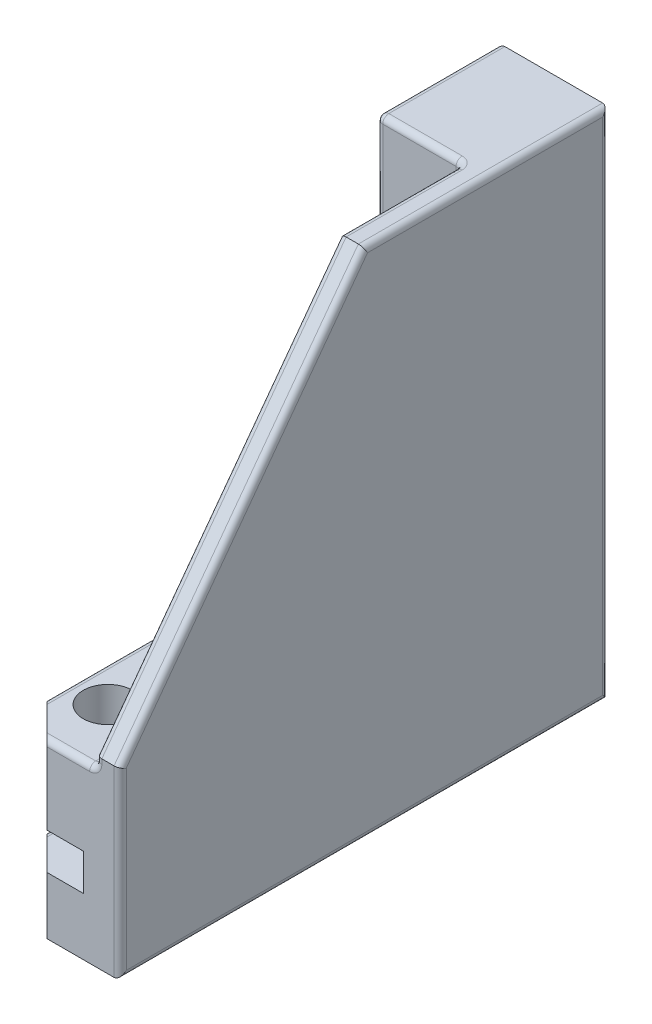
from build123d import *

# Parameters (mm, degrees)
SKETCH1_W           = 9
SKETCH1_H           = 42
SKETCH1_R           = 2.02
SKETCH1_R_2         = 1.5875
BOSS_EXTRUDE1_DEPTH = 40
SKETCH1_3_R         = 2.02
SKETCH1_3_R_2       = 1.5875
CUT_EXTRUDE1_DEPTH  = 8
SKETCH2_W           = 40
SKETCH2_H           = 3
CUT_EXTRUDE2_DEPTH  = 6
CUT_EXTRUDE3_DEPTH  = 9
CUT_EXTRUDE6_DEPTH  = 7
SKETCH6_R           = 2.0193
CUT_EXTRUDE5_DEPTH  = 20
FILLET2_R           = 0.5
CHAMFER4_SIZE       = 3
SKETCH7_W           = 74.310151154
SKETCH7_H           = 95.165931092
CUT_EXTRUDE7_DEPTH  = 9
FILLET3_R           = 0.5


with BuildPart() as part:
    # Sketch1 → Boss-Extrude1 (new body)
    # profile 1 of 4: a face of its own
    with BuildSketch(Plane.XY):
        with Locations((4.5, 21)):
            Rectangle(SKETCH1_W, SKETCH1_H)
        with Locations((4.5, 16)):
            Circle(SKETCH1_R, mode=Mode.SUBTRACT)
        with Locations((4.5, 28)):
            Circle(SKETCH1_R, mode=Mode.SUBTRACT)
    # profile 2 of 4: a face of its own
    with BuildSketch(Plane.XY):
        with Locations((4.5, 28)):
            Circle(SKETCH1_R)
    # profile 3 of 4: a face of its own
    with BuildSketch(Plane.XY):
        with Locations((4.5, 16)):
            Circle(SKETCH1_R)
    # profile 4 of 4: a face of its own
    with BuildSketch(Plane.XY):
        with Locations((4.5, 35)):
            Circle(SKETCH1_R_2)
    extrude(amount=BOSS_EXTRUDE1_DEPTH)

    # Sketch1<3> → Cut-Extrude1 (cut)
    with BuildSketch(Plane.XY):
        with Locations((4.5, 28)):
            Circle(SKETCH1_3_R)
        with Locations((4.5, 35)):
            Circle(SKETCH1_3_R_2)
        with Locations((4.5, 16)):
            Circle(SKETCH1_3_R)
    extrude(amount=CUT_EXTRUDE1_DEPTH, mode=Mode.SUBTRACT)

    # Sketch2 → Cut-Extrude2 (cut)
    with BuildSketch(Plane(origin=(9, 0, 0), x_dir=(0, 0, -1), z_dir=(1, 0, 0))):
        with Locations((-20, 6.2)):
            Rectangle(SKETCH2_W, SKETCH2_H)
    extrude(amount=-CUT_EXTRUDE2_DEPTH, mode=Mode.SUBTRACT)

    # Sketch3 → Cut-Extrude3 (cut)
    with BuildSketch(Plane(origin=(9, 0, 0), x_dir=(0, 0, -1), z_dir=(1, 0, 0))):
        Polygon((-20, 42), (-40, 15), (-48.379363257, 51.913157268), align=None)
    extrude(amount=-CUT_EXTRUDE3_DEPTH, mode=Mode.SUBTRACT)

    # Sketch5 → Cut-Extrude6 (cut)
    with BuildSketch(Plane.ZY.offset(-9)):
        Polygon((20, 42), (10, 42), (10, 14.1), (40, 14.1), (40, 15), align=None)
    extrude(amount=CUT_EXTRUDE6_DEPTH, mode=Mode.SUBTRACT)

    # Sketch6 → Cut-Extrude5 (cut)
    with BuildSketch(Plane.XZ):
        with Locations(Location((6, 35, 0), (0, 0, 90))):
            Circle(SKETCH6_R)
        with Locations(Location((6, 20, 0), (0, 0, 90))):
            Circle(SKETCH6_R)
    extrude(amount=-CUT_EXTRUDE5_DEPTH, mode=Mode.SUBTRACT)

    # Fillet2
    fillet2_edges = [part.edges().sort_by_distance(p)[0] for p in [
        (0, 0, 20),
        (0, 7.5, 40),
        (0, 42, 10),
        (0, 28.5, 30),
        (0, 21, 0),
    ]]
    fillet(fillet2_edges, radius=FILLET2_R)

    # Chamfer4
    chamfer4_edges = [part.edges().sort_by_distance(p)[0] for p in [
        (9, 2.35, 40),
        (9, 10.9, 40),
    ]]
    chamfer(chamfer4_edges, length=CHAMFER4_SIZE)

    # Mirror1: part across plane


with BuildPart() as part_1:
    add(part.part)
    add(part.part.mirror(Plane(origin=(9, 0, 40), x_dir=(0, 0, 1), z_dir=(-1, 0, 0))))

    # Sketch7 → Cut-Extrude7 (cut)
    with BuildSketch(Plane.ZY):
        with Locations((29.906214843, 26.493385896)):
            Rectangle(SKETCH7_W, SKETCH7_H)
    extrude(amount=-CUT_EXTRUDE7_DEPTH, mode=Mode.SUBTRACT)

    # Fillet3
    fillet3_edges = [part_1.edges().sort_by_distance(p)[0] for p in [
        (16, 42, 15),
        (16, 14.55, 40),
        (14, 14.1, 40),
        (16, 28.5, 30),
        (16, 14.1, 25),
        (16, 28.05, 10),
        (9, 2.35, 37),
        (9, 10.9, 37),
        (12.5, 42, 10),
        (9, 2.35, 0),
        (9, 0, 18.5),
        (9, 4.7, 18.5),
        (9, 24.85, 0),
        (9, 7.7, 18.5),
        (9, 42, 5),
        (9, 28.05, 10),
        (9, 14.1, 23.5),
    ]]
    fillet(fillet3_edges, radius=FILLET3_R)


solid = part_1.part
